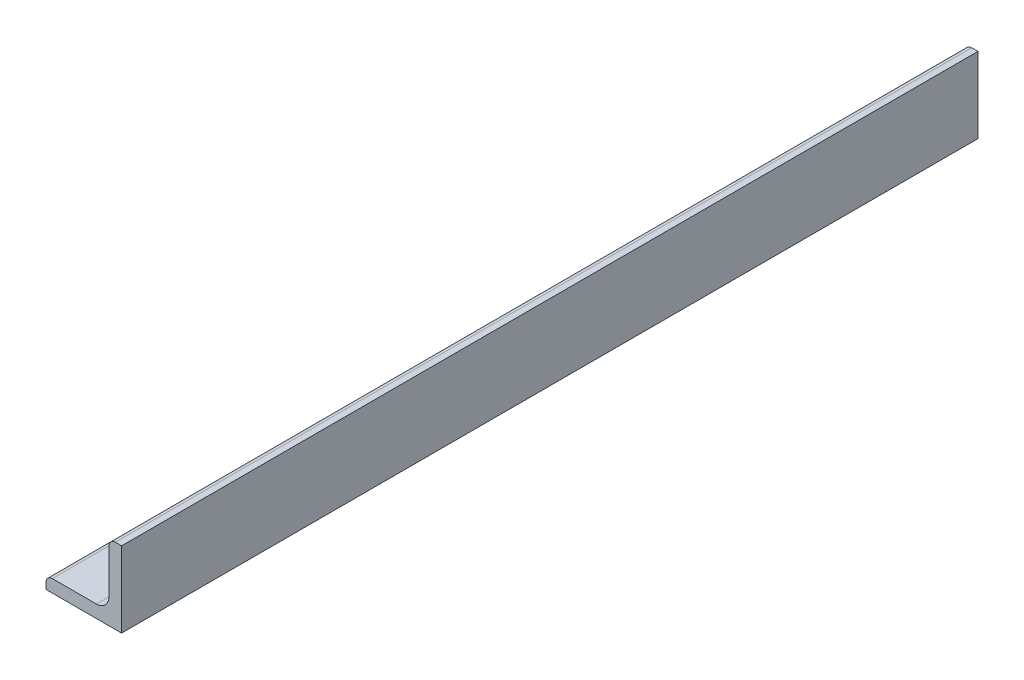
from build123d import *

# Parameters (mm, degrees)
BOSS_EXTRUDE1_DEPTH   = 107.95
F_6_32_TAPPED_HOLE1_D = 2.7051


with BuildPart() as part:
    # Sketch2 → Boss-Extrude1 (new, symmetric)
    with BuildSketch(Plane.XY):
        with BuildLine():
            Line((-9.525, 0), (9.525, 0))
            Line((9.525, 0), (9.525, 19.05))
            Line((9.525, 19.05), (7.9375, 19.05))
            ThreePointArc((7.9375, 19.05), (6.814967985, 18.585032015), (6.35, 17.4625))
            Line((6.35, 17.4625), (6.35, 6.35))
            ThreePointArc((6.35, 6.35), (5.42006403, 4.10493597), (3.175, 3.175))
            Line((3.175, 3.175), (-7.9375, 3.175))
            ThreePointArc((-7.9375, 3.175), (-9.060032015, 2.710032015), (-9.525, 1.5875))
            Line((-9.525, 1.5875), (-9.525, 0))
        make_face()
    extrude(amount=BOSS_EXTRUDE1_DEPTH, both=True)

    # #6-32 Tapped Hole1 (through all)
    with Locations(Plane(origin=(0, 3.175, 0), x_dir=(1, 0, 0), z_dir=(0, 1, 0))):
        with Locations((-0.2937383, -95.25), (-0.2937383, 95.25)):
            Hole(F_6_32_TAPPED_HOLE1_D / 2)


solid = part.part
